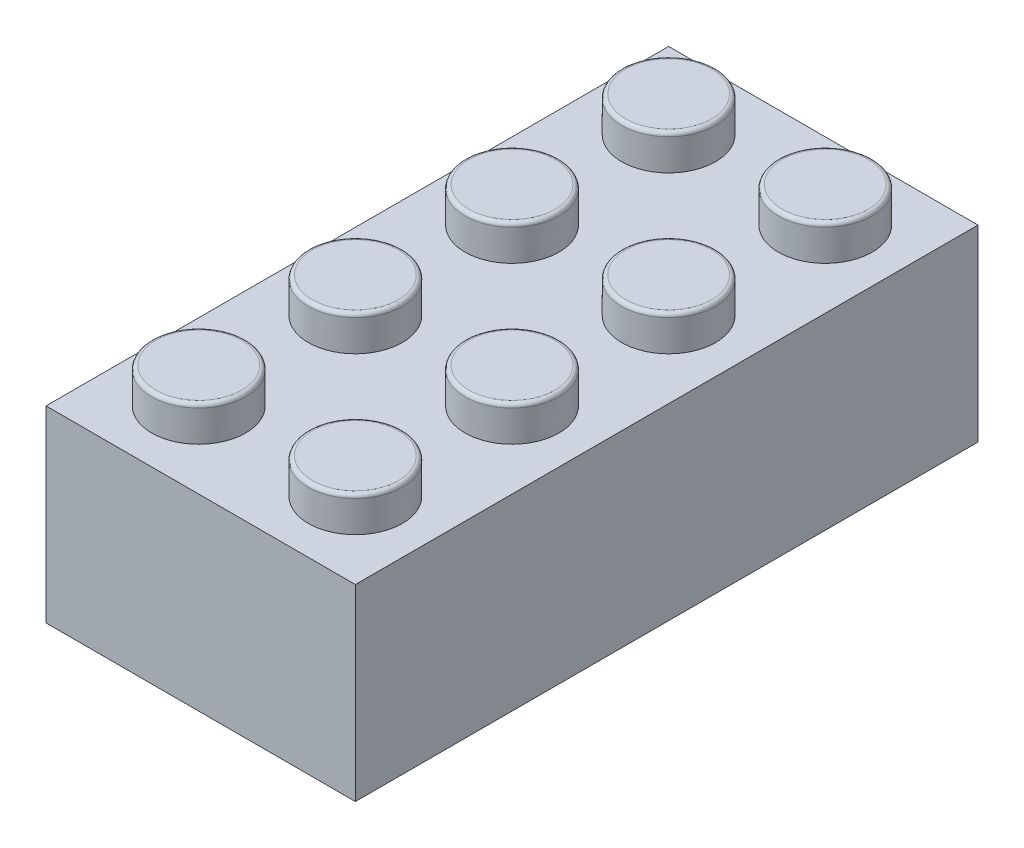
from build123d import *

# Parameters (mm, degrees)
SKETCH3_W           = 15.8
SKETCH3_H           = 9.6
BOSS_EXTRUDE1_DEPTH = 31.8
SKETCH5_R           = 2.4
BOSS_EXTRUDE2_DEPTH = 1.8
SHELL1_T            = -1
SKETCH6_R           = 3.255
SKETCH6_R_2         = 2.4
BOSS_EXTRUDE3_DEPTH = 8.6
SKETCH8_RX          = 0.3
SKETCH8_RY          = 0.2
BOSS_EXTRUDE4_DEPTH = 8.6
SKETCH9_RX          = 0.3
SKETCH9_RY          = 0.2
BOSS_EXTRUDE5_DEPTH = 8.6
BOSS_EXTRUDE6_DEPTH = 6.3
FILLET3_R           = 0.2


with BuildPart() as part:
    # Sketch3 → Boss-Extrude1 (new body)
    with BuildSketch(Plane.XY):
        with Locations((7.9, 4.8)):
            Rectangle(SKETCH3_W, SKETCH3_H)
    extrude(amount=BOSS_EXTRUDE1_DEPTH)

    # Sketch5 → Boss-Extrude2 (add)
    with BuildSketch(Plane(origin=(0, 9.6, 0), x_dir=(1, 0, 0), z_dir=(0, 1, 0))):
        with Locations(Location((3.9, -3.9, 0), (0, 0, 90))):
            Circle(SKETCH5_R)
        with Locations(Location((11.9, -3.9, 0), (0, 0, 90))):
            Circle(SKETCH5_R)
        with Locations(Location((11.9, -11.9, 0), (0, 0, 90))):
            Circle(SKETCH5_R)
        with Locations(Location((11.9, -19.9, 0), (0, 0, 90))):
            Circle(SKETCH5_R)
        with Locations(Location((11.9, -27.9, 0), (0, 0, 90))):
            Circle(SKETCH5_R)
        with Locations(Location((3.9, -11.9, 0), (0, 0, 90))):
            Circle(SKETCH5_R)
        with Locations(Location((3.9, -19.9, 0), (0, 0, 90))):
            Circle(SKETCH5_R)
        with Locations(Location((3.9, -27.9, 0), (0, 0, 90))):
            Circle(SKETCH5_R)
    extrude(amount=BOSS_EXTRUDE2_DEPTH)

    # Shell1
    shell1_openings = [part.faces().sort_by_distance(p)[0] for p in [
        (7.9, 0, 15.9),
    ]]
    offset(amount=SHELL1_T, openings=shell1_openings, kind=Kind.INTERSECTION)

    # Sketch6 → Boss-Extrude3 (add)
    # profile 1 of 3: a face of its own
    with BuildSketch(Plane(origin=(0, 8.6, 0), x_dir=(-1, 0, 0), z_dir=(0, -1, 0))):
        with Locations(Location((-7.9, -23.9, 0), (0, 0, 270))):
            Circle(SKETCH6_R)
        with Locations(Location((-7.9, -23.9, 0), (0, 0, 270))):
            Circle(SKETCH6_R_2, mode=Mode.SUBTRACT)
    # profile 2 of 3: a face of its own
    with BuildSketch(Plane(origin=(0, 8.6, 0), x_dir=(-1, 0, 0), z_dir=(0, -1, 0))):
        with Locations(Location((-7.9, -15.9, 0), (0, 0, 270))):
            Circle(SKETCH6_R)
        with Locations(Location((-7.9, -15.9, 0), (0, 0, 270))):
            Circle(SKETCH6_R_2, mode=Mode.SUBTRACT)
    # profile 3 of 3: a face of its own
    with BuildSketch(Plane(origin=(0, 8.6, 0), x_dir=(-1, 0, 0), z_dir=(0, -1, 0))):
        with Locations(Location((-7.9, -7.9, 0), (0, 0, 270))):
            Circle(SKETCH6_R)
        with Locations(Location((-7.9, -7.9, 0), (0, 0, 270))):
            Circle(SKETCH6_R_2, mode=Mode.SUBTRACT)
    extrude(amount=BOSS_EXTRUDE3_DEPTH)

    # Sketch8 → Boss-Extrude4 (add)
    with BuildSketch(Plane.XZ.offset(-8.6)):
        with Locations(Location((1, 27.9), (0, 0, -90))):
            Ellipse(SKETCH8_RX, SKETCH8_RY)
        with Locations(Location((14.8, 27.9), (0, 0, -90))):
            Ellipse(SKETCH8_RX, SKETCH8_RY)
        with Locations(Location((14.8, 19.9), (0, 0, -90))):
            Ellipse(SKETCH8_RX, SKETCH8_RY)
        with Locations(Location((14.8, 11.9), (0, 0, -90))):
            Ellipse(SKETCH8_RX, SKETCH8_RY)
        with Locations(Location((14.8, 3.9), (0, 0, -90))):
            Ellipse(SKETCH8_RX, SKETCH8_RY)
        with Locations(Location((1, 19.9), (0, 0, -90))):
            Ellipse(SKETCH8_RX, SKETCH8_RY)
        with Locations(Location((1, 11.9), (0, 0, -90))):
            Ellipse(SKETCH8_RX, SKETCH8_RY)
        with Locations(Location((1, 3.9), (0, 0, -90))):
            Ellipse(SKETCH8_RX, SKETCH8_RY)
    extrude(amount=BOSS_EXTRUDE4_DEPTH)

    # Sketch9 → Boss-Extrude5 (add)
    with BuildSketch(Plane.XZ.offset(-8.6)):
        with Locations((3.9, 30.8)):
            Ellipse(SKETCH9_RX, SKETCH9_RY)
        with Locations(Location((11.9, 30.8), (0, 0, 180))):
            Ellipse(SKETCH9_RX, SKETCH9_RY)
        with Locations((11.9, 1)):
            Ellipse(SKETCH9_RX, SKETCH9_RY)
        with Locations((3.9, 1)):
            Ellipse(SKETCH9_RX, SKETCH9_RY)
    extrude(amount=BOSS_EXTRUDE5_DEPTH)

    # Sketch10 → Boss-Extrude6 (add)
    with BuildSketch(Plane.XZ.offset(-8.6)):
        with BuildLine():
            ThreePointArc((4.670045019, 15.496991535), (4.645001412, 15.896968559), (4.669299964, 16.296991535))
            Line((4.669299964, 16.296991535), (1, 16.296991535))
            Line((1, 16.296991535), (1, 15.496991535))
            Line((1, 15.496991535), (4.670045019, 15.496991535))
        make_face()
        with BuildLine():
            Line((14.8, 16.296991535), (11.130700036, 16.296991535))
            ThreePointArc((11.130700036, 16.296991535), (11.148919329, 16.098867272), (11.155, 15.9))
            ThreePointArc((11.155, 15.9), (11.148732712, 15.698107036), (11.129954981, 15.496991535))
            Line((11.129954981, 15.496991535), (14.8, 15.496991535))
            Line((14.8, 15.496991535), (14.8, 16.296991535))
        make_face()
    extrude(amount=BOSS_EXTRUDE6_DEPTH)

    # Fillet3
    fillet3_edges = [part.edges().sort_by_distance(p)[0] for p in [
        (3.9, 11.4, 6.3),
        (11.9, 11.4, 6.3),
        (11.9, 11.4, 14.3),
        (11.9, 11.4, 22.3),
        (11.9, 11.4, 30.3),
        (3.9, 11.4, 14.3),
        (3.9, 11.4, 22.3),
        (3.9, 11.4, 30.3),
    ]]
    fillet(fillet3_edges, radius=FILLET3_R)


solid = part.part
